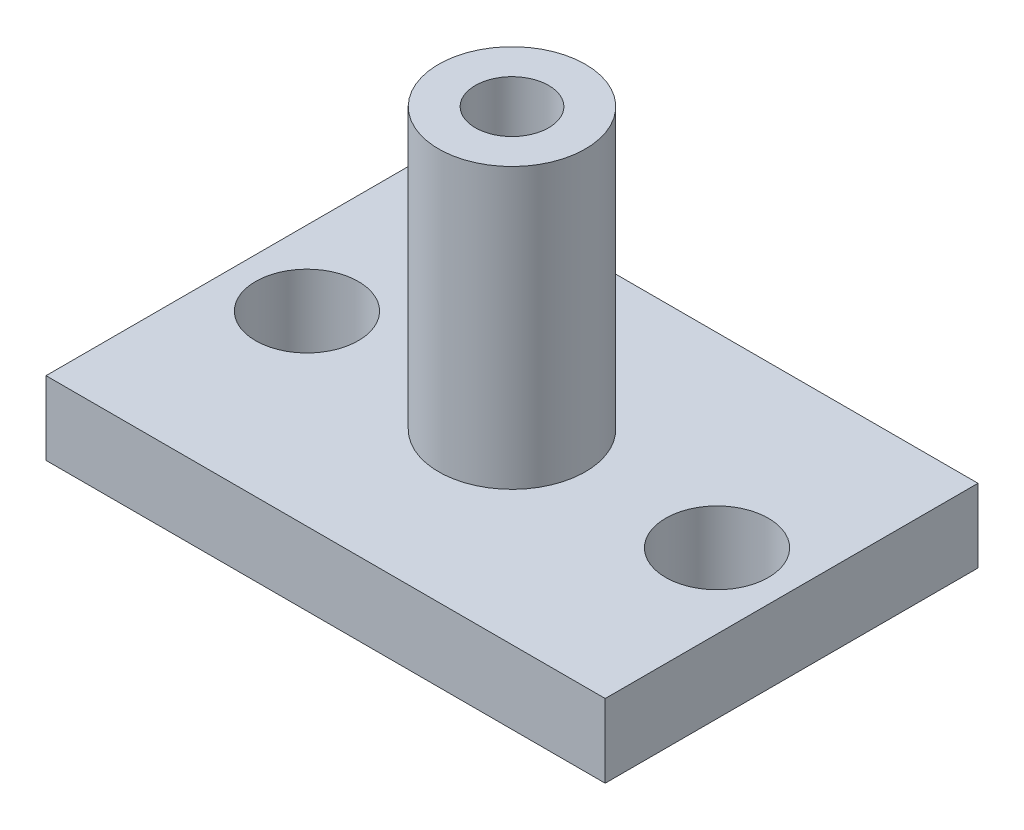
from build123d import *

# Parameters (mm, degrees)
SKETCH1_W           = 38.1
SKETCH1_H           = 25.4
BOSS_EXTRUDE1_DEPTH = 5
SKETCH3_R           = 5
SKETCH3_R_2         = 2.5
BOSS_EXTRUDE2_DEPTH = 19.05
SKETCH4_R           = 3.5
CUT_EXTRUDE1_DEPTH  = 35.525178946


with BuildPart() as part:
    # Sketch1 → Boss-Extrude1 (new body)
    with BuildSketch(Plane(origin=(0, 0, 0), x_dir=(1, 0, 0), z_dir=(0, 1, 0))):
        with Locations((-6.79173913, 0)):
            Rectangle(SKETCH1_W, SKETCH1_H)
    extrude(amount=BOSS_EXTRUDE1_DEPTH)

    # Sketch3 → Boss-Extrude2 (add)
    with BuildSketch(Plane(origin=(0, 5, 0), x_dir=(1, 0, 0), z_dir=(0, 1, 0))):
        with Locations((-6.79173913, 0)):
            Circle(SKETCH3_R)
        with Locations((-6.79173913, 0)):
            Circle(SKETCH3_R_2, mode=Mode.SUBTRACT)
    extrude(amount=BOSS_EXTRUDE2_DEPTH)

    # Sketch4 → Cut-Extrude1 (cut, through all)
    with BuildSketch(Plane(origin=(0, 5, 0), x_dir=(1, 0, 0), z_dir=(0, 1, 0))):
        with Locations((7.17826087, 0)):
            Circle(SKETCH4_R)
        with Locations((-20.76173913, 0)):
            Circle(SKETCH4_R)
    extrude(amount=-CUT_EXTRUDE1_DEPTH, mode=Mode.SUBTRACT)


solid = part.part
